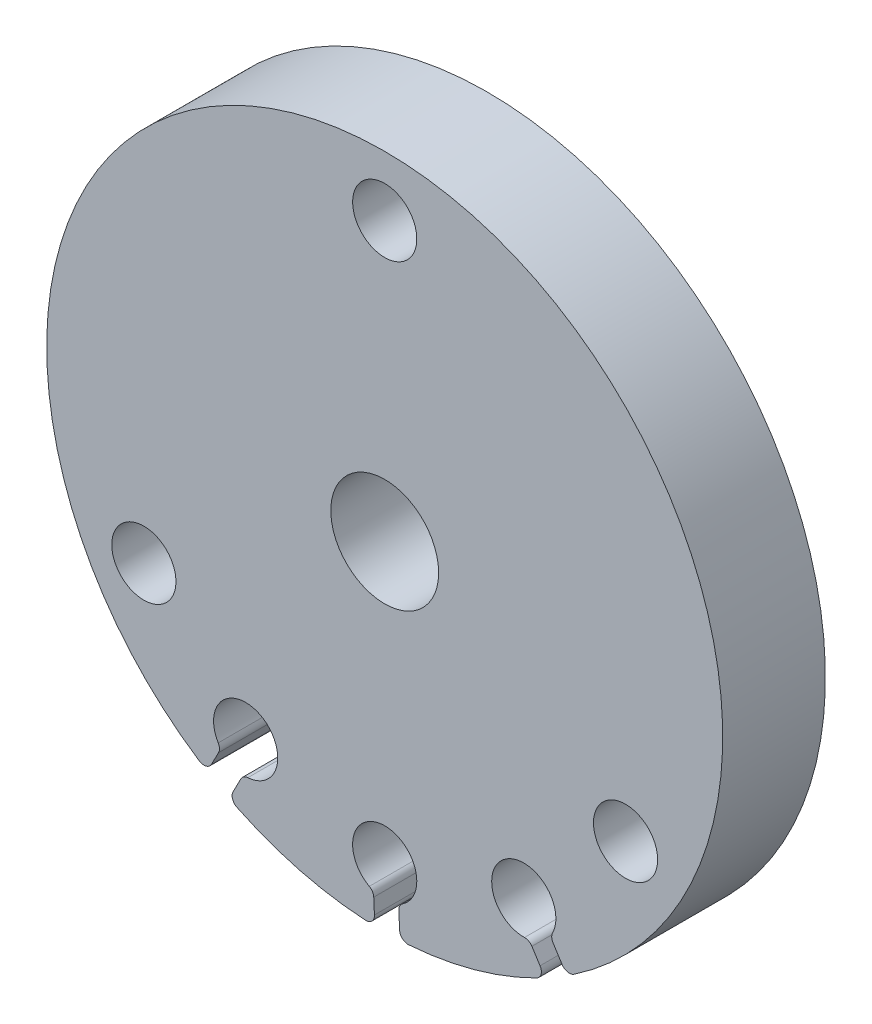
from build123d import *

# Parameters (mm, degrees)
SKETCH_1_R          = 19.75
SKETCH_1_R_2        = 3.15
EXTRUDE_1_DEPTH     = 6
SKETCH_2_R          = 1.875
CUT_EXTRUDE_2_DEPTH = 29.567901568
FILLET_1_R          = 0.5


with BuildPart() as part:
    # Эскиз1 → Бобышка-Вытянуть1 (new body)
    with BuildSketch(Plane.XY):
        Circle(SKETCH_1_R)
        Circle(SKETCH_1_R_2, mode=Mode.SUBTRACT)
    extrude(amount=EXTRUDE_1_DEPTH)

    # Эскиз2 → Вырез-Вытянуть2 (cut, through all)
    with BuildSketch(Plane(origin=(0, 0, 0), x_dir=(-1, 0, 0), z_dir=(0, 0, -1))):
        with Locations((-14.072912811, -8.125)):
            Circle(SKETCH_2_R)
        with Locations((0, 16.25)):
            Circle(SKETCH_2_R)
        with Locations((14.072912811, -8.125)):
            Circle(SKETCH_2_R)
        with BuildLine():
            Line((-10.964367017, -17.151598034), (-9.672796655, -15.131189956))
            ThreePointArc((-9.672796655, -15.131189956), (-7.115101419, -12.493124896), (-8.435759199, -15.92198115))
            Line((-8.435759199, -15.92198115), (-9.697895423, -17.896345301))
            Line((-9.697895423, -17.896345301), (-10.964367017, -17.151598034))
        make_face()
        with BuildLine():
            Line((9.371536104, -18.07121939), (8.267596564, -15.942482607))
            ThreePointArc((8.267596564, -15.942482607), (7.261812823, -12.408421028), (9.570960555, -15.266572341))
            Line((9.570960555, -15.266572341), (10.649741954, -17.34679645))
            Line((10.649741954, -17.34679645), (9.371536104, -18.07121939))
        make_face()
        with BuildLine():
            Line((-0.919621357, -20.335903121), (-0.811292651, -17.940393219))
            ThreePointArc((-0.811292651, -17.940393219), (0.084703869, -14.376914243), (0.655408809, -18.006719754))
            Line((0.655408809, -18.006719754), (0.549548851, -20.347637377))
            Line((0.549548851, -20.347637377), (-0.919621357, -20.335903121))
        make_face()
    extrude(amount=-CUT_EXTRUDE_2_DEPTH, mode=Mode.SUBTRACT)

    # Скругление1
    fillet_1_edges = [part.edges().sort_by_distance(p)[0] for p in [
        (9.371126789, -17.385179973, 3),
        (10.637598383, -16.640432706, 3),
        (8.435759199, -15.92198115, 3),
        (9.672796655, -15.131189956, 3),
        (-10.370444112, -16.808223848, 3),
        (-9.092238262, -17.532646788, 3),
        (-9.570960555, -15.266572341, 3),
        (-8.267596564, -15.942482607, 3),
        (0.892214082, -19.729836645, 3),
        (-0.576956126, -19.741570901, 3),
        (-0.655408809, -18.006719754, 3),
        (0.811292651, -17.940393219, 3),
    ]]
    fillet(fillet_1_edges, radius=FILLET_1_R)


solid = part.part
